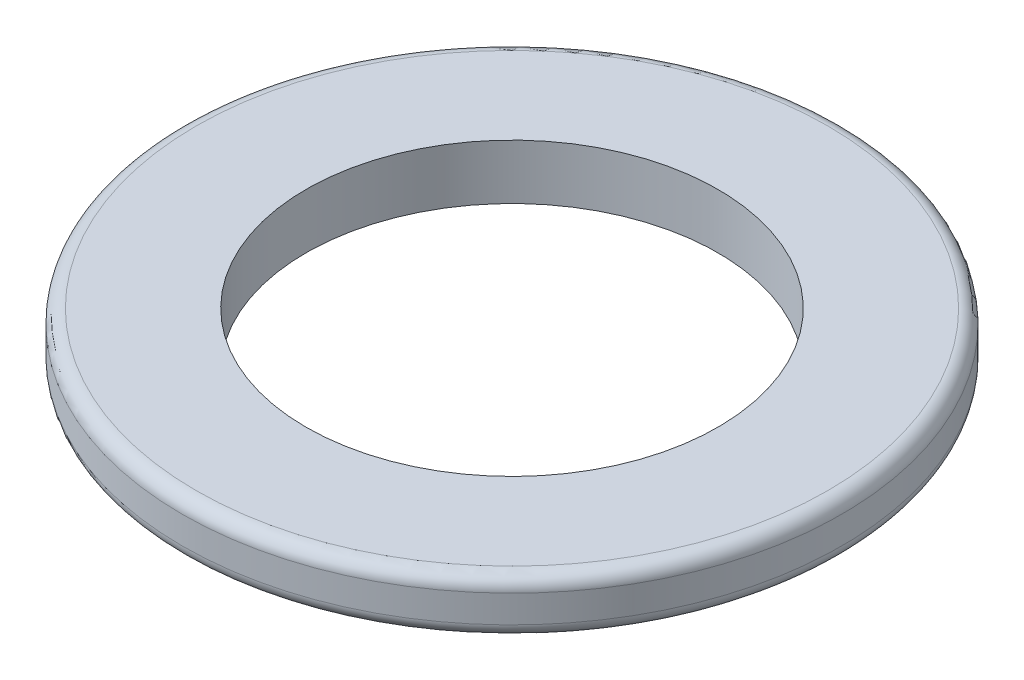
from build123d import *

# Parameters (mm, degrees)
SKETCH1_R           = 2.4
SKETCH1_R_2         = 1.5
BOSS_EXTRUDE1_DEPTH = 0.4
FILLET1_R           = 0.1


with BuildPart() as part:
    # Sketch1 → Boss-Extrude1 (new body)
    with BuildSketch(Plane(origin=(0, 0, 0), x_dir=(1, 0, 0), z_dir=(0, 1, 0))):
        with Locations(Location((0, 0, 0), (0, 0, 270))):
            Circle(SKETCH1_R)
        with Locations(Location((0, 0, 0), (0, 0, 270))):
            Circle(SKETCH1_R_2, mode=Mode.SUBTRACT)
    extrude(amount=BOSS_EXTRUDE1_DEPTH)

    # Fillet1
    fillet1_edges = [part.edges().sort_by_distance(p)[0] for p in [
        (0, 0, -2.4),
        (0, 0.4, -2.4),
    ]]
    fillet(fillet1_edges, radius=FILLET1_R)


solid = part.part
